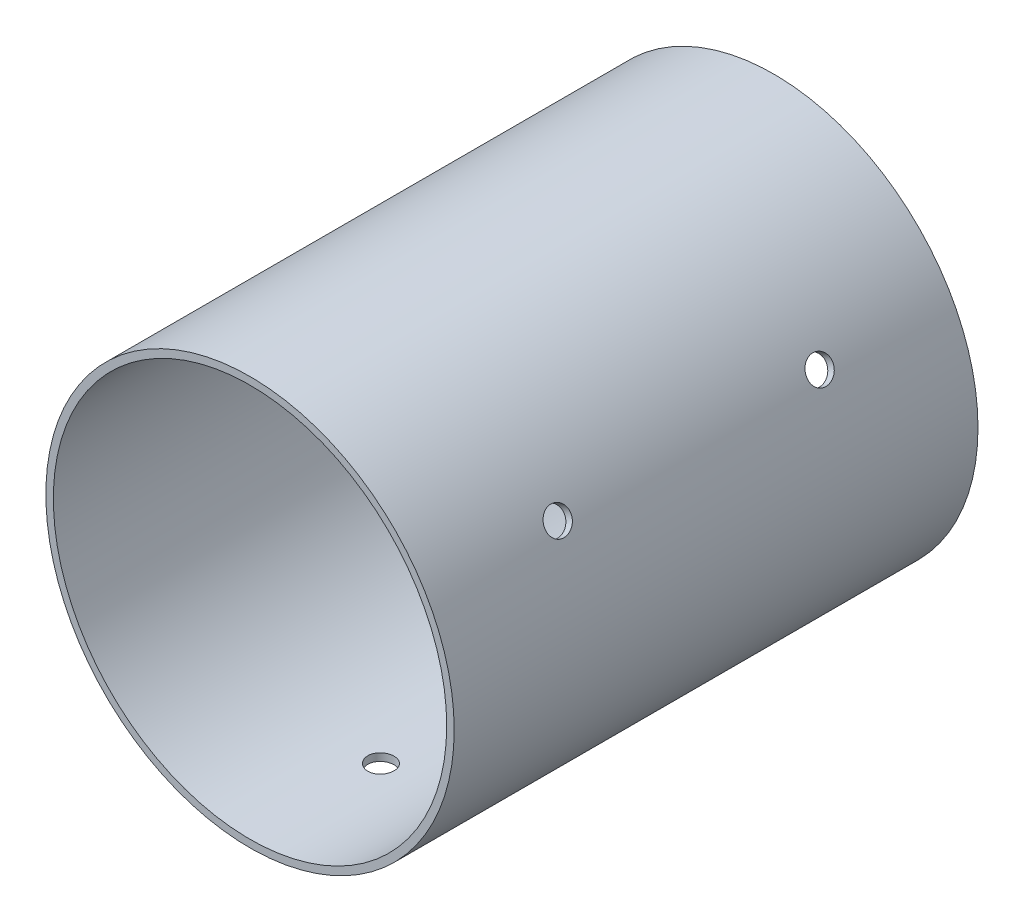
from build123d import *

# Parameters (mm, degrees)
SKETCH1_R           = 49.5046
SKETCH1_R_2         = 47.6885
BOSS_EXTRUDE1_DEPTH = 127
SKETCH4_R           = 3.175
CUT_EXTRUDE3_DEPTH  = 146.018656877
CIRPATTERN2_COUNT   = 3


with BuildPart() as part:
    # Sketch1 → Boss-Extrude1 (new body)
    with BuildSketch(Plane.XY):
        Circle(SKETCH1_R)
        Circle(SKETCH1_R_2, mode=Mode.SUBTRACT)
    extrude(amount=BOSS_EXTRUDE1_DEPTH)

    # Sketch4 → Cut-Extrude3 (cut, through all)
    with BuildSketch(Plane(origin=(0, 0, 0), x_dir=(1, 0, 0), z_dir=(0, 1, 0))):
        with Locations(Location((0, -31.75, 0), (0, 0, 270))):
            Circle(SKETCH4_R)
        with Locations(Location((0, -95.25, 0), (0, 0, 270))):
            Circle(SKETCH4_R)
    cut_extrude3 = extrude(amount=-CUT_EXTRUDE3_DEPTH, mode=Mode.SUBTRACT)

    # CirPattern2: Cut-Extrude3 ×3 about axis
    cirpattern2_axis = Axis((0, 0, 127), (0, 0, -1))
    for i in range(1, CIRPATTERN2_COUNT):
        add(cut_extrude3.rotate(cirpattern2_axis, i * 360 / CIRPATTERN2_COUNT), mode=Mode.SUBTRACT)


solid = part.part
